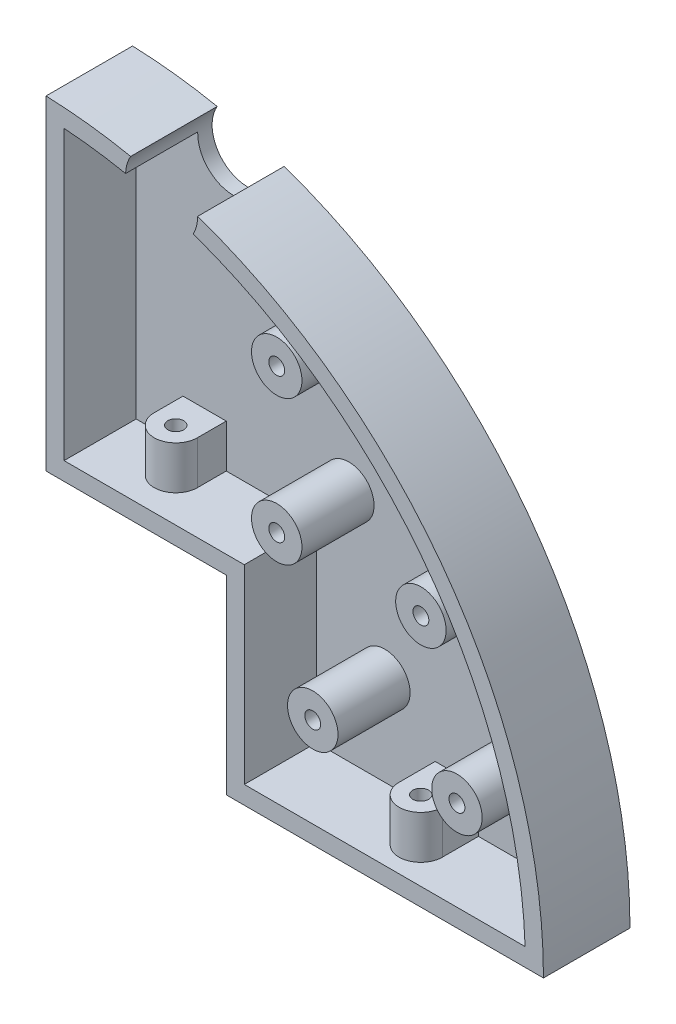
from build123d import *

# Parameters (mm, degrees)
BOSS_EXTRUDE1_DEPTH = 2.54
BOSS_EXTRUDE2_DEPTH = 12.7
BOSS_EXTRUDE3_DEPTH = 7.62
SKETCH5_R           = 1.397
CUT_EXTRUDE1_DEPTH  = 104.117521798
SKETCH6_R           = 4.445
BOSS_EXTRUDE4_DEPTH = 12.7
SKETCH7_R           = 6.35
CUT_EXTRUDE2_DEPTH  = 130.279824509
SKETCH8_R           = 1.397
CUT_EXTRUDE3_DEPTH  = 130.279824509
BOSS_EXTRUDE5_DEPTH = 7.62
SKETCH10_R          = 1.397
CUT_EXTRUDE4_DEPTH  = 122.944757421


with BuildPart() as part:
    # Sketch2 → Boss-Extrude1 (new body)
    with BuildSketch(Plane.XY):
        with BuildLine():
            Line((34.925, 0), (90.805, 0))
            ThreePointArc((90.805, 0), (65.321718823, 63.07631152), (3.175, 90.749476032))
            Line((3.175, 90.749476032), (3.175, 33.528))
            Line((3.175, 33.528), (34.925, 33.528))
            Line((34.925, 33.528), (34.925, 0))
        make_face()
    extrude(amount=BOSS_EXTRUDE1_DEPTH)

    # Sketch3 → Boss-Extrude2 (add)
    with BuildSketch(Plane.XY.offset(2.54)):
        with BuildLine():
            Line((34.925, 33.528), (34.925, 0))
            Line((34.925, 0), (90.805, 0))
            ThreePointArc((90.805, 0), (65.321718823, 63.07631152), (3.175, 90.749476032))
            Line((3.175, 90.749476032), (3.175, 33.528))
            Line((3.175, 33.528), (34.925, 33.528))
        make_face()
        with BuildLine():
            Line((6.35, 36.703), (38.1, 36.703))
            Line((38.1, 36.703), (38.1, 3.175))
            Line((38.1, 3.175), (87.572462995, 3.175))
            ThreePointArc((87.572462995, 3.175), (63.077762451, 60.829374353), (6.35, 87.399624713))
            Line((6.35, 87.399624713), (6.35, 36.703))
        make_face(mode=Mode.SUBTRACT)
    extrude(amount=BOSS_EXTRUDE2_DEPTH)

    # Sketch4 → Boss-Extrude3 (add)
    with BuildSketch(Plane(origin=(0, 36.703, 0), x_dir=(1, 0, 0), z_dir=(0, 1, 0))):
        with BuildLine():
            Line((14.605, -7.62), (14.605, 0))
            Line((14.605, 0), (22.225, 0))
            Line((22.225, 0), (22.225, -7.62))
            ThreePointArc((22.225, -7.62), (18.415, -11.43), (14.605, -7.62))
        make_face()
    extrude(amount=BOSS_EXTRUDE3_DEPTH)

    # Sketch5 → Cut-Extrude1 (cut, through all)
    with BuildSketch(Plane(origin=(0, 44.323, 0), x_dir=(1, 0, 0), z_dir=(0, 1, 0))):
        with Locations(Location((18.415, -7.62, 0), (0, 0, 180))):
            Circle(SKETCH5_R)
    extrude(amount=-CUT_EXTRUDE1_DEPTH, mode=Mode.SUBTRACT)

    # Sketch6 → Boss-Extrude4 (add)
    with BuildSketch(Plane.XY.offset(2.54)):
        with Locations((43.815, 44.45)):
            Circle(SKETCH6_R)
        with Locations((43.815, 69.85)):
            Circle(SKETCH6_R)
        with Locations((50.165, 19.05)):
            Circle(SKETCH6_R)
        with Locations((75.565, 19.05)):
            Circle(SKETCH6_R)
        with Locations((69.215, 44.45)):
            Circle(SKETCH6_R)
    extrude(amount=BOSS_EXTRUDE4_DEPTH)

    # Sketch7 → Cut-Extrude2 (cut, through all)
    with BuildSketch(Plane.XY.offset(15.24)):
        with Locations((23.540776994, 85.726552587)):
            Circle(SKETCH7_R)
    extrude(amount=-CUT_EXTRUDE2_DEPTH, mode=Mode.SUBTRACT)

    # Sketch8 → Cut-Extrude3 (cut, through all)
    with BuildSketch(Plane.XY.offset(15.24)):
        with Locations((43.815, 69.85)):
            Circle(SKETCH8_R)
        with Locations((43.815, 44.45)):
            Circle(SKETCH8_R)
        with Locations((69.215, 44.45)):
            Circle(SKETCH8_R)
        with Locations((75.565, 19.05)):
            Circle(SKETCH8_R)
        with Locations((50.165, 19.05)):
            Circle(SKETCH8_R)
    extrude(amount=-CUT_EXTRUDE3_DEPTH, mode=Mode.SUBTRACT)

    # Sketch9 → Boss-Extrude5 (add)
    with BuildSketch(Plane(origin=(0, 3.175, 0), x_dir=(1, 0, 0), z_dir=(0, 1, 0))):
        with BuildLine():
            Line((66.646231497, -8.89), (66.646231497, -2.54))
            Line((66.646231497, -2.54), (59.026231497, -2.54))
            Line((59.026231497, -2.54), (59.026231497, -8.89))
            ThreePointArc((59.026231497, -8.89), (62.836231497, -12.7), (66.646231497, -8.89))
        make_face()
    extrude(amount=BOSS_EXTRUDE5_DEPTH)

    # Sketch10 → Cut-Extrude4 (cut, through all)
    with BuildSketch(Plane(origin=(0, 10.795, 0), x_dir=(1, 0, 0), z_dir=(0, 1, 0))):
        with Locations(Location((62.836231497, -8.89, 0), (0, 0, 270))):
            Circle(SKETCH10_R)
    extrude(amount=-CUT_EXTRUDE4_DEPTH, mode=Mode.SUBTRACT)


solid = part.part
